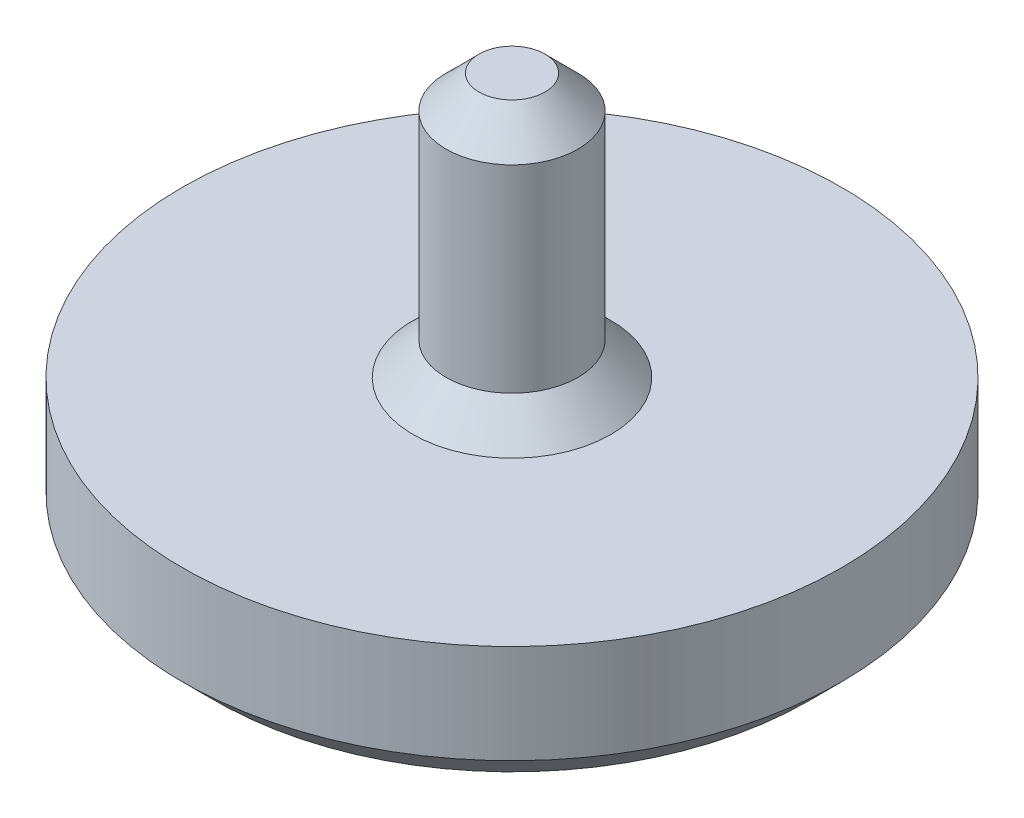
from build123d import *

# Parameters (mm, degrees)
CHAMFER1_SIZE = 0.5


with BuildPart() as part:
    # Sketch1 → Revolve1 (revolve)
    with BuildSketch(Plane.XY, mode=Mode.PRIVATE) as revolve1_sk:
        Polygon((0, 4), (-1, 4), (-1, 0), (-5, 0), (-5, -2), (0, -2), align=None)
    revolve(revolve1_sk.sketch.rotate(Axis((0, 0, 0), (0, 1, 0)), 180), axis=Axis((0, 0, 0), (0, 1, 0)))

    # Chamfer1
    chamfer1_edges = [part.edges().sort_by_distance(p)[0] for p in [
        (-5, -2, 0),
        (-1, 0, 0),
        (-1, 4, 0),
    ]]
    chamfer(chamfer1_edges, length=CHAMFER1_SIZE)


solid = part.part
